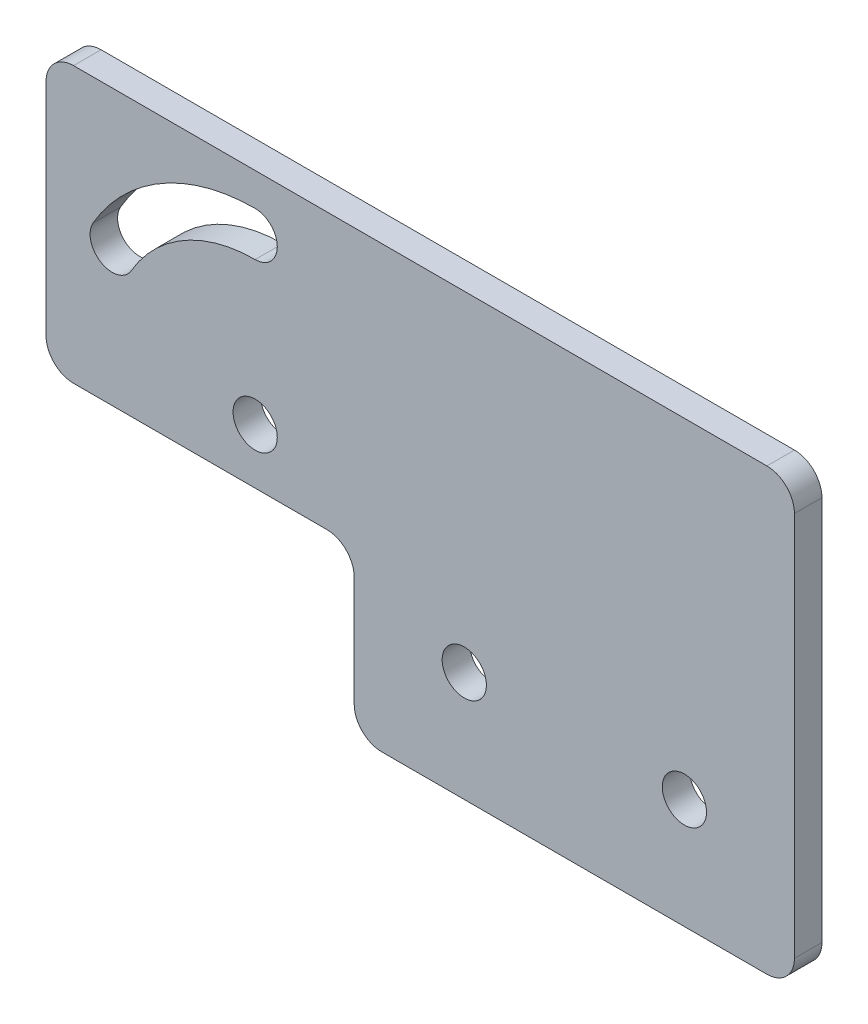
from build123d import *

# Parameters (mm, degrees)
SKETCH1_W           = 50.8
SKETCH1_H           = 50.8
SKETCH1_R           = 2.5527
SKETCH1_W_2         = 35.56
SKETCH1_H_2         = 31.75
BOSS_EXTRUDE1_DEPTH = 3.175
FILLET1_R           = 3.175


with BuildPart() as part:
    # Sketch1 → Boss-Extrude1 (new body)
    # profile 1 of 2: a face of its own
    with BuildSketch(Plane.XY):
        with Locations((25.4, 25.4)):
            Rectangle(SKETCH1_W, SKETCH1_H)
        with Locations((38.1, 12.7)):
            Circle(SKETCH1_R, mode=Mode.SUBTRACT)
        with Locations((12.7, 12.7)):
            Circle(SKETCH1_R, mode=Mode.SUBTRACT)
    # profile 2 of 2: a face of its own
    with BuildSketch(Plane.XY):
        with Locations((-17.78, 34.925)):
            Rectangle(SKETCH1_W_2, SKETCH1_H_2)
        with Locations((-11.43, 25.4)):
            Circle(SKETCH1_R, mode=Mode.SUBTRACT)
        with BuildLine():
            ThreePointArc((-25.717080894, 33.64865), (-29.204133942, 32.714296952), (-30.13848699, 36.20135))
            ThreePointArc((-30.13848699, 36.20135), (-22.23135, 44.10848699), (-11.43, 47.0027))
            ThreePointArc((-11.43, 47.0027), (-8.8773, 44.45), (-11.43, 41.8973))
            ThreePointArc((-11.43, 41.8973), (-19.67865, 39.687080894), (-25.717080894, 33.64865))
        make_face(mode=Mode.SUBTRACT)
    extrude(amount=BOSS_EXTRUDE1_DEPTH)

    # Fillet1
    fillet1_edges = [part.edges().sort_by_distance(p)[0] for p in [
        (0, 0, 1.5875),
        (0, 19.05, 1.5875),
        (-35.56, 19.05, 1.5875),
        (-35.56, 50.8, 1.5875),
        (50.8, 50.8, 1.5875),
        (50.8, 0, 1.5875),
    ]]
    fillet(fillet1_edges, radius=FILLET1_R)


solid = part.part
